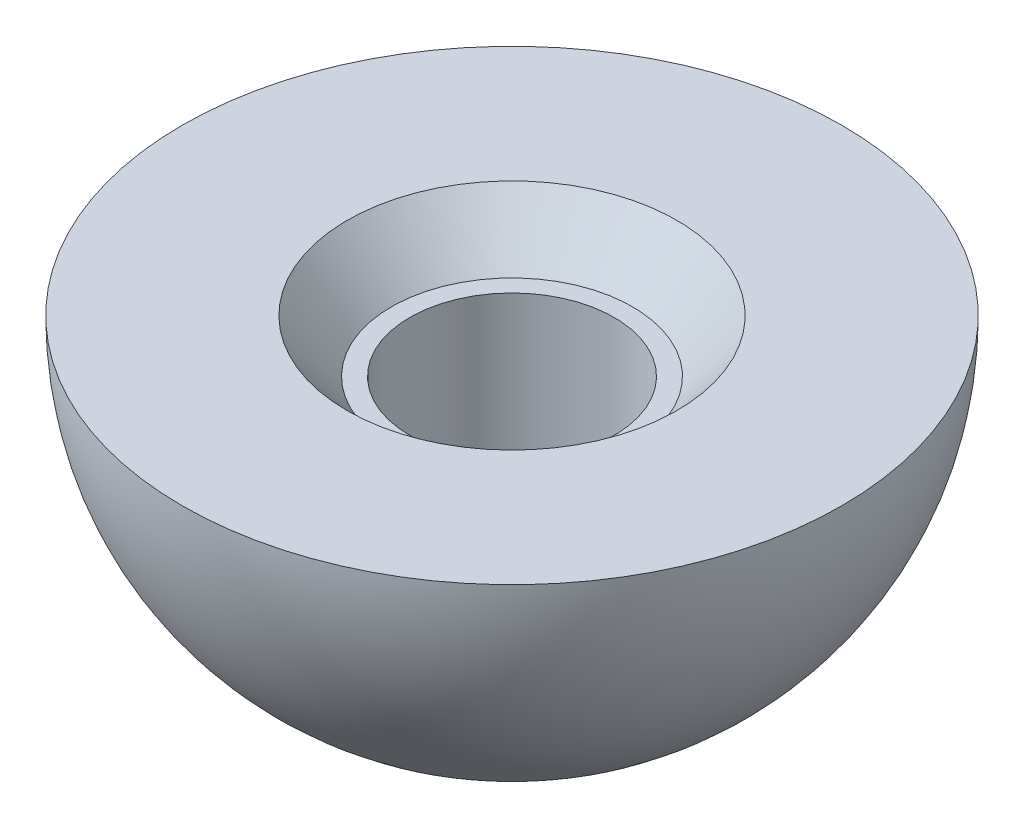
from build123d import *

# Parameters (mm, degrees)
REVOLVE1_ANGLE     = 180
SKETCH2_R          = 1.55
CUT_EXTRUDE1_DEPTH = 9.660254038
SKETCH3_R          = 2.5
CUT_EXTRUDE2_DEPTH = 0.8
CUT_EXTRUDE2_DRAFT = -40


with BuildPart() as part:
    # Sketch1 → Revolve1 (revolve)
    with BuildSketch(Plane(origin=(0, 0, 0), x_dir=(1, 0, 0), z_dir=(0, 1, 0))):
        with BuildLine():
            Line((5, 0), (-5, 0))
            ThreePointArc((-5, 0), (0, 5), (5, 0))
        make_face()
    revolve(axis=Axis((5, 0, 0), (-1, 0, 0)), revolution_arc=REVOLVE1_ANGLE)

    # Sketch2 → Cut-Extrude1 (cut, through all)
    with BuildSketch(Plane(origin=(0, 0, 0), x_dir=(1, 0, 0), z_dir=(0, 1, 0))):
        with Locations(Location((0, 0, 0), (0, 0, 270))):
            Circle(SKETCH2_R)
    extrude(amount=-CUT_EXTRUDE1_DEPTH, mode=Mode.SUBTRACT)


with BuildPart() as cut_extrude2_tool:
    # Sketch3 → Cut-Extrude2 (with draft: the straight prism first)
    with BuildSketch(Plane(origin=(0, 0, 0), x_dir=(1, 0, 0), z_dir=(0, 1, 0))):
        Circle(SKETCH3_R)
    extrude(amount=-CUT_EXTRUDE2_DEPTH)
    # Cut-Extrude2: the draft: its side faces are tilted about the plane it starts from
    cut_extrude2_sides = [cut_extrude2_tool.faces().sort_by_distance(p)[0] for p in [
        (-2.5, -0.4, 0),
    ]]
    draft(cut_extrude2_sides, Plane(origin=(0, 0, 0), x_dir=(1, 0, 0), z_dir=(0, 1, 0)), CUT_EXTRUDE2_DRAFT)


with BuildPart() as part_1:
    add(part.part)

    # Cut-Extrude2: cut by cut_extrude2_tool
    add(cut_extrude2_tool.part, mode=Mode.SUBTRACT)


solid = part_1.part
